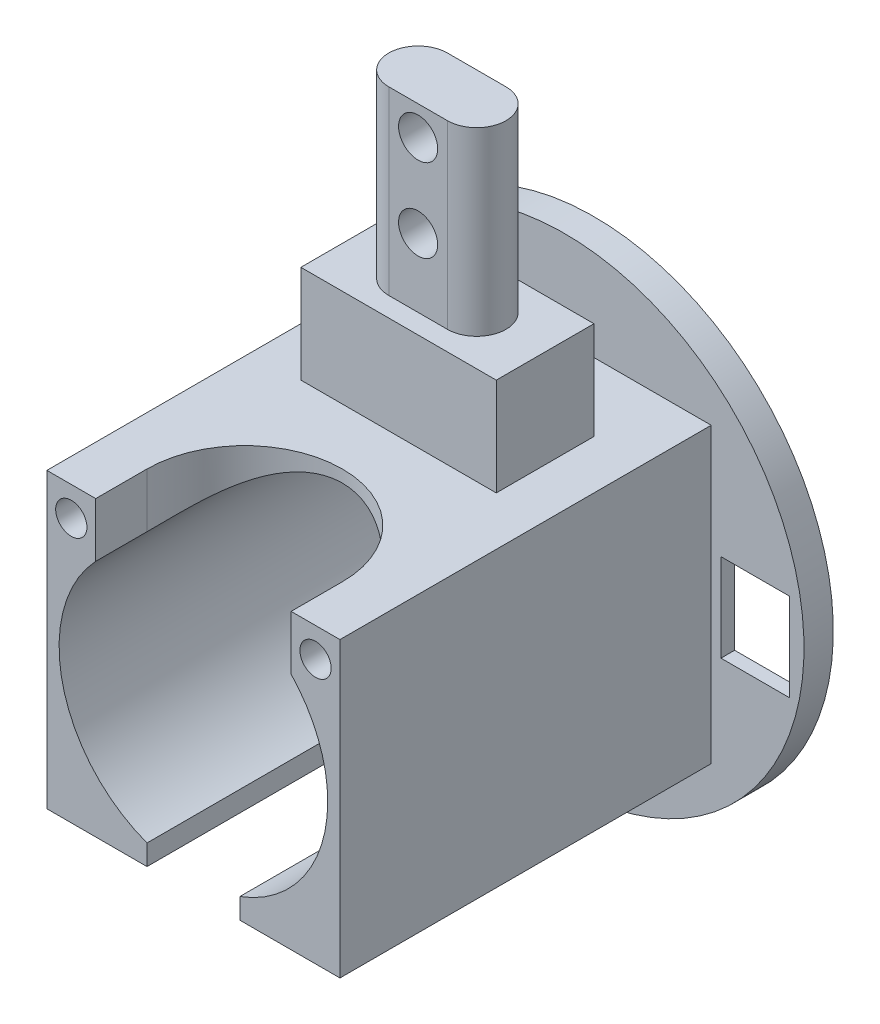
from build123d import *

# Parameters (mm, degrees)
SKETCH1_W                = 30
SKETCH1_H                = 30
BOSS_EXTRUDE1_DEPTH      = 38
CUT_EXTRUDE3_REACH       = 45.52
SKETCH2_R                = 13.25
SKETCH4_R                = 13.75
CUT_EXTRUDE4_DEPTH       = 37
SKETCH5_R                = 24.5
BOSS_EXTRUDE4_DEPTH      = 3
SKETCH8_R                = 23.75
CUT_EXTRUDE8_DEPTH       = 1.6
SKETCH9_R                = 13.25
CUT_EXTRUDE9_DEPTH       = 1.6
CUT_EXTRUDE10_REACH      = 53.425
SKETCH10_W               = 7
SKETCH10_H               = 9
CUT_EXTRUDE11_REACH      = 62.037
CUT_EXTRUDE11_END_RADIUS = 13.75
CUT_EXTRUDE12_REACH      = 62.037
CUT_EXTRUDE12_END_RADIUS = 13.75
SKETCH14_W               = 20
SKETCH14_H               = 10
BOSS_EXTRUDE5_DEPTH      = 10
BOSS_EXTRUDE6_DEPTH      = 18.5
CUT_EXTRUDE13_REACH      = 59.736
SKETCH16_R               = 2
SKETCH17_R               = 1.6
CUT_EXTRUDE14_DEPTH      = 10


with BuildPart() as part:
    # Sketch1 → Boss-Extrude1 (new body)
    with BuildSketch(Plane.XY):
        Rectangle(SKETCH1_W, SKETCH1_H)
    extrude(amount=BOSS_EXTRUDE1_DEPTH)

    # Sketch2 → Cut-Extrude3 (cut, up to next)
    with BuildSketch(Plane.XY.offset(38), mode=Mode.PRIVATE) as cut_extrude3_sk1:
        Circle(SKETCH2_R)
    cut_extrude3_tool1 = extrude(cut_extrude3_sk1.sketch, amount=-CUT_EXTRUDE3_REACH, mode=Mode.PRIVATE) & part.part
    add(cut_extrude3_tool1.solids().sort_by_distance((0, 0, 38))[0], mode=Mode.SUBTRACT)

    # Sketch4 → Cut-Extrude4 (cut)
    with BuildSketch(Plane.XY.offset(38)):
        Circle(SKETCH4_R)
    extrude(amount=-CUT_EXTRUDE4_DEPTH, mode=Mode.SUBTRACT)

    # Sketch5 → Boss-Extrude4 (add)
    with BuildSketch(Plane(origin=(0, 0, 0), x_dir=(-1, 0, 0), z_dir=(0, 0, -1))):
        Circle(SKETCH5_R)
    extrude(amount=BOSS_EXTRUDE4_DEPTH)

    # Sketch8 → Cut-Extrude8 (cut)
    with BuildSketch(Plane(origin=(0, 0, -3), x_dir=(-1, 0, 0), z_dir=(0, 0, -1))):
        Circle(SKETCH8_R)
    extrude(amount=-CUT_EXTRUDE8_DEPTH, mode=Mode.SUBTRACT)

    # Sketch9 → Cut-Extrude9 (cut)
    with BuildSketch(Plane.XY):
        Circle(SKETCH9_R)
    extrude(amount=-CUT_EXTRUDE9_DEPTH, mode=Mode.SUBTRACT)

    # Sketch10 → Cut-Extrude10 (cut, up to next)
    with BuildSketch(Plane.XY, mode=Mode.PRIVATE) as cut_extrude10_sk1:
        with Locations((19.5, -0.647719384)):
            Rectangle(SKETCH10_W, SKETCH10_H)
    cut_extrude10_tool1 = extrude(cut_extrude10_sk1.sketch, amount=-CUT_EXTRUDE10_REACH, mode=Mode.PRIVATE) & part.part
    add(cut_extrude10_tool1.solids().sort_by_distance((19.5, -0.647719, 0))[0], mode=Mode.SUBTRACT)

    # Cut-Extrude11: up to this cylinder (the profile starts outside it)
    cut_extrude11_end = Plane(origin=(0, 0, 27.875), z_dir=(0, 0, 1)) * Cylinder(CUT_EXTRUDE11_END_RADIUS, 152.574, mode=Mode.PRIVATE)
    # Sketch12 → Cut-Extrude11 (cut, up to the surface)
    with BuildSketch(Plane(origin=(0, -15, 0), x_dir=(-1, 0, 0), z_dir=(0, -1, 0)), mode=Mode.PRIVATE) as cut_extrude11_sk1:
        with BuildLine():
            Line((-4.75, -38), (-4.75, -17.75))
            ThreePointArc((-4.75, -17.75), (0, -13), (4.75, -17.75))
            Line((4.75, -17.75), (4.75, -38))
            ThreePointArc((4.75, -38), (0, -42.75), (-4.75, -38))
        make_face()
    cut_extrude11_tool1 = extrude(cut_extrude11_sk1.sketch, amount=-CUT_EXTRUDE11_REACH, mode=Mode.PRIVATE) - cut_extrude11_end
    add(cut_extrude11_tool1.solids().sort_by_distance((0, -15, 27.875))[0], mode=Mode.SUBTRACT)

    # Cut-Extrude12: up to this cylinder (the profile starts outside it)
    cut_extrude12_end = Plane(origin=(0, 0, 35.375), z_dir=(0, 0, 1)) * Cylinder(CUT_EXTRUDE12_END_RADIUS, 152.574, mode=Mode.PRIVATE)
    # Sketch13 → Cut-Extrude12 (cut, up to the surface)
    with BuildSketch(Plane(origin=(0, 15, 0), x_dir=(1, 0, 0), z_dir=(0, 1, 0)), mode=Mode.PRIVATE) as cut_extrude12_sk1:
        with BuildLine():
            Line((-10, -38), (-10, -32.75))
            ThreePointArc((-10, -32.75), (0, -22.75), (10, -32.75))
            Line((10, -32.75), (10, -38))
            ThreePointArc((10, -38), (0, -48), (-10, -38))
        make_face()
    cut_extrude12_tool1 = extrude(cut_extrude12_sk1.sketch, amount=-CUT_EXTRUDE12_REACH, mode=Mode.PRIVATE) - cut_extrude12_end
    add(cut_extrude12_tool1.solids().sort_by_distance((0, 15, 35.375))[0], mode=Mode.SUBTRACT)

    # Sketch14 → Boss-Extrude5 (add)
    with BuildSketch(Plane(origin=(0, 15, 0), x_dir=(1, 0, 0), z_dir=(0, 1, 0))):
        with Locations((0, -12)):
            Rectangle(SKETCH14_W, SKETCH14_H)
    extrude(amount=BOSS_EXTRUDE5_DEPTH)

    # Sketch15 → Boss-Extrude6 (add)
    with BuildSketch(Plane(origin=(0, 25, 0), x_dir=(1, 0, 0), z_dir=(0, 1, 0))):
        with BuildLine():
            Line((-3, -9), (3, -9))
            ThreePointArc((3, -9), (6, -12), (3, -15))
            Line((3, -15), (-3, -15))
            ThreePointArc((-3, -15), (-6, -12), (-3, -9))
        make_face()
    extrude(amount=BOSS_EXTRUDE6_DEPTH)

    # Sketch16 → Cut-Extrude13 (cut, up to next)
    with BuildSketch(Plane(origin=(0, 0, 9), x_dir=(-1, 0, 0), z_dir=(0, 0, -1)), mode=Mode.PRIVATE) as cut_extrude13_sk1:
        with Locations((0, 40.5)):
            Circle(SKETCH16_R)
    cut_extrude13_tool1 = extrude(cut_extrude13_sk1.sketch, amount=-CUT_EXTRUDE13_REACH, mode=Mode.PRIVATE) & part.part
    # Sketch16 → Cut-Extrude13 (cut, up to next)
    with BuildSketch(Plane(origin=(0, 0, 9), x_dir=(-1, 0, 0), z_dir=(0, 0, -1)), mode=Mode.PRIVATE) as cut_extrude13_sk2:
        with Locations((0, 32)):
            Circle(SKETCH16_R)
    cut_extrude13_tool2 = extrude(cut_extrude13_sk2.sketch, amount=-CUT_EXTRUDE13_REACH, mode=Mode.PRIVATE) & part.part
    add(cut_extrude13_tool1.solids().sort_by_distance((0, 40.5, 9))[0], mode=Mode.SUBTRACT)
    add(cut_extrude13_tool2.solids().sort_by_distance((0, 32, 9))[0], mode=Mode.SUBTRACT)

    # Sketch17 → Cut-Extrude14 (cut)
    with BuildSketch(Plane.XY.offset(38)):
        with Locations((12.5, 12)):
            Circle(SKETCH17_R)
        with Locations((-12.5, 12)):
            Circle(SKETCH17_R)
    extrude(amount=-CUT_EXTRUDE14_DEPTH, mode=Mode.SUBTRACT)


solid = part.part
